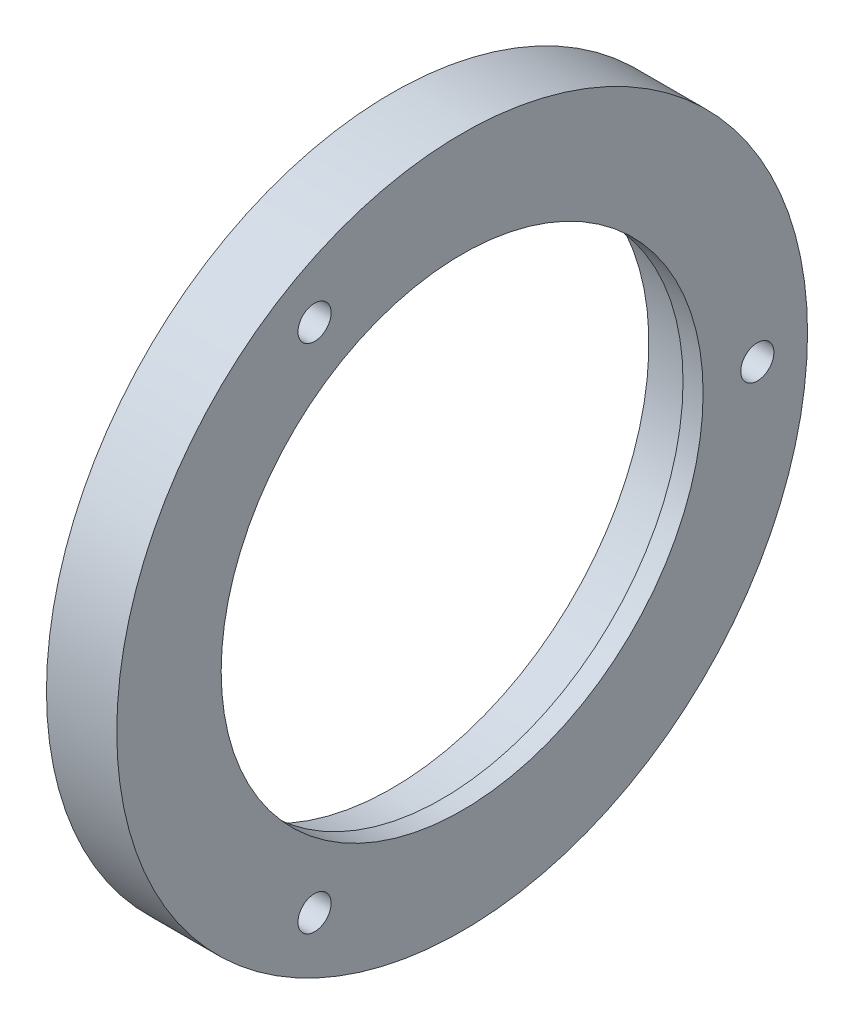
from build123d import *

# Parameters (mm, degrees)
AXIAL_HOLES_DEPTH      = 184.274684558
AXIAL_HOLES_DEPTH_BACK = 184.274684558
SKETCH2_R              = 1.65


with BuildPart() as part:
    # Axial profile (mm) → Full revolution (revolve)
    with BuildSketch(Plane.XY, mode=Mode.PRIVATE) as full_revolution_sk:
        Polygon((169.7, 25.6), (174.7, 25.6), (174.7, 24), (176.7, 24), (176.7, 34.4), (169.7, 34.4), align=None)
    revolve(full_revolution_sk.sketch.rotate(Axis((-110, 0, 0), (1, 0, 0)), 90), axis=Axis((-110, 0, 0), (1, 0, 0)))

    # Sketch2 → Axial holes (cut, two sides: drawn at the far end of the back side and taken through both)
    with BuildSketch(Plane(origin=(0, 0, 0), x_dir=(0, 0, -1), z_dir=(1, 0, 0)).offset(-AXIAL_HOLES_DEPTH_BACK)):
        with Locations(Location((29.4, 0, 0), (0, 0, 180))):
            Circle(SKETCH2_R)
        with Locations(Location((-14.7, 25.461146871, 0), (0, 0, 180))):
            Circle(SKETCH2_R)
        with Locations(Location((-14.7, -25.461146871, 0), (0, 0, 180))):
            Circle(SKETCH2_R)
    extrude(amount=AXIAL_HOLES_DEPTH + AXIAL_HOLES_DEPTH_BACK, mode=Mode.SUBTRACT)


solid = part.part
